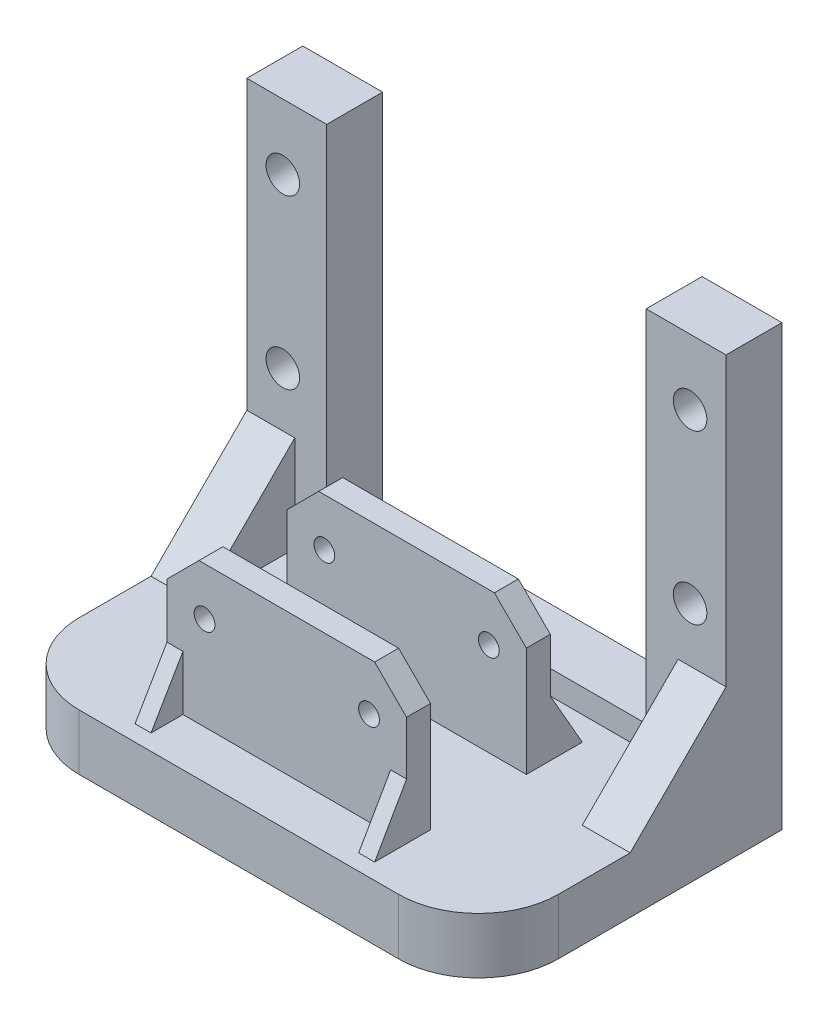
from build123d import *

# Parameters (mm, degrees)
SKETCH_2_R          = 1.3
EXTRUDE_1_DEPTH     = 9
SKETCH_3_W          = 30
SKETCH_3_H          = 20.835575778
CUT_EXTRUDE_1_DEPTH = 6
EXTRUDE_START       = -6.7
EXTRUDE_2_DEPTH     = 7
EXTRUDE_3_DEPTH     = 2
EXTRUDE_4_DEPTH     = 2
SKETCH_11_R         = 2.1
EXTRUDE_5_DEPTH     = 7
EXTRUDE_6_DEPTH     = 6
EXTRUDE_7_DEPTH     = 6


with BuildPart() as part:
    # 草图2 → 凸台-拉伸1 (new, symmetric)
    with BuildSketch(Plane.XY):
        Polygon((-11, 11), (11, 11), (15, 7), (15, -11), (-15, -11), (-15, 7), align=None)
        with Locations((-10.3, 5)):
            Circle(SKETCH_2_R, mode=Mode.SUBTRACT)
        with Locations(Location((10.3, 5, 0), (0, 0, 180))):
            Circle(SKETCH_2_R, mode=Mode.SUBTRACT)
    extrude(amount=EXTRUDE_1_DEPTH, both=True)

    # 草图3 → 切除-拉伸1 (cut, symmetric)
    with BuildSketch(Plane.XY):
        with Locations((0, 3.717787889)):
            Rectangle(SKETCH_3_W, SKETCH_3_H)
    extrude(amount=CUT_EXTRUDE_1_DEPTH, both=True, mode=Mode.SUBTRACT)

    # 草图6 → 凸台-拉伸2 (add)
    with BuildSketch(Plane(origin=(0, 0, 0), x_dir=(1, 0, 0), z_dir=(0, 1, 0)).offset(EXTRUDE_START)):
        with BuildLine():
            Line((-20, -15), (20, -15))
            ThreePointArc((20, -15), (27.071067812, -12.071067812), (30, -5))
            Line((30, -5), (30, 23))
            Line((30, 23), (-30, 23))
            Line((-30, 23), (-30, -5))
            ThreePointArc((-30, -5), (-27.071067812, -12.071067812), (-20, -15))
        make_face()
    extrude(amount=-EXTRUDE_2_DEPTH)

    # 草图7 → 凸台-拉伸3 (add)
    with BuildSketch(Plane(origin=(15, 0, 0), x_dir=(0, 0, -1), z_dir=(1, 0, 0))):
        Polygon((-9, 0.3), (-13, -6.7), (-9, -6.7), align=None)
        Polygon((9, -6.7), (9, 0.3), (13, -6.7), align=None)
    extrude(amount=-EXTRUDE_3_DEPTH)

    # 草图10 → 凸台-拉伸4 (add)
    with BuildSketch(Plane.ZY.offset(15)):
        Polygon((-9, 0.15), (-13, -6.7), (-9, -6.7), align=None)
        Polygon((9, -6.7), (9, 0.15), (13, -6.7), align=None)
    extrude(amount=-EXTRUDE_4_DEPTH)

    # 草图11 → 凸台-拉伸5 (add)
    with BuildSketch(Plane.XY.offset(-23)):
        Polygon((-30, -11.7), (30, -11.7), (30, 41.3), (20, 41.3), (20, -3.7), (-20, -3.7), (-20, 41.3), (-30, 41.3), align=None)
        with Locations((-25.5, 33.1)):
            Circle(SKETCH_11_R, mode=Mode.SUBTRACT)
        with Locations((-25.5, 12.1)):
            Circle(SKETCH_11_R, mode=Mode.SUBTRACT)
        with Locations(Location((25.5, 12.1, 0), (0, 0, 180))):
            Circle(SKETCH_11_R, mode=Mode.SUBTRACT)
        with Locations(Location((25.5, 33.1, 0), (0, 0, 180))):
            Circle(SKETCH_11_R, mode=Mode.SUBTRACT)
    extrude(amount=EXTRUDE_5_DEPTH)

    # 草图12 → 凸台-拉伸6 (add)
    with BuildSketch(Plane.ZY.offset(30)):
        Polygon((-4, -6.7), (-16, 5.3), (-16, -6.7), align=None)
    extrude(amount=-EXTRUDE_6_DEPTH)

    # 草图13 → 凸台-拉伸7 (add)
    with BuildSketch(Plane(origin=(30, 0, 0), x_dir=(0, 0, -1), z_dir=(1, 0, 0))):
        Polygon((16, -6.7), (16, 5.3), (4, -6.7), align=None)
    extrude(amount=-EXTRUDE_7_DEPTH)


solid = part.part
